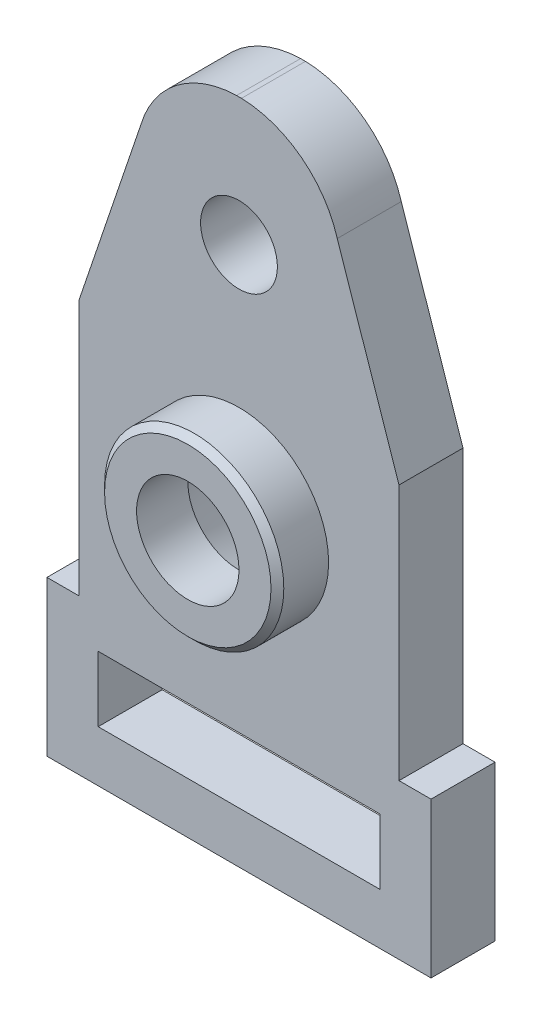
from build123d import *

# Parameters (mm, degrees)
SKETCH_1_W          = 4
SKETCH_1_H          = 5.1
EXTRUDE_1_DEPTH     = 5
SKETCH_2_R          = 3
CUT_EXTRUDE_1_DEPTH = 10
SKETCH_3_R          = 7
SKETCH_3_R_2        = 4
EXTRUDE_2_DEPTH     = 4
CHAMFER_1_SIZE      = 0.5
SKETCH_4_R          = 4
CUT_EXTRUDE_2_DEPTH = 10
CUT_EXTRUDE_2_DRAFT = 20


with BuildPart() as part:
    # Эскиз1 → Бобышка-Вытянуть1 (new body)
    with BuildSketch(Plane.XY):
        with BuildLine():
            ThreePointArc((7.674867745, 14.259797906), (4.86875016, 18.350131705), (0.190816738, 20))
            Line((0.190816738, 20), (-0.190816738, 20))
            ThreePointArc((-0.190816738, 20), (-4.86875016, 18.350131705), (-7.674867745, 14.259797906))
            Line((-7.674867745, 14.259797906), (-12.5, 0))
            Line((-12.5, 0), (-12.5, -20))
            Line((-12.5, -20), (12.5, -20))
            Line((12.5, -20), (12.5, 0))
            Line((12.5, 0), (7.674867745, 14.259797906))
        make_face()
        Polygon((15, -32.1), (15, -28.1), (11, -28.1), (-11, -28.1), (-15, -28.1), (-15, -32.1), align=None)
        with Locations((13, -25.55)):
            Rectangle(SKETCH_1_W, SKETCH_1_H)
        Polygon((15, -20), (12.5, -20), (-12.5, -20), (-15, -20), (-15, -23), (-11, -23), (11, -23), (15, -23), align=None)
        with Locations((-13, -25.55)):
            Rectangle(SKETCH_1_W, SKETCH_1_H)
    extrude(amount=EXTRUDE_1_DEPTH)

    # Эскиз2 → Вырез-Вытянуть1 (cut)
    with BuildSketch(Plane.XY.offset(5)):
        with Locations((0, 10)):
            Circle(SKETCH_2_R)
    extrude(amount=-CUT_EXTRUDE_1_DEPTH, mode=Mode.SUBTRACT)

    # Эскиз3 → Бобышка-Вытянуть2 (add)
    with BuildSketch(Plane.XY.offset(5)):
        with Locations((0, -8)):
            Circle(SKETCH_3_R)
        with Locations((0, -8)):
            Circle(SKETCH_3_R_2, mode=Mode.SUBTRACT)
    extrude(amount=EXTRUDE_2_DEPTH)

    # Фаска1
    chamfer_1_edges = [part.edges().sort_by_distance(p)[0] for p in [
        (-7, -8, 9),
    ]]
    chamfer(chamfer_1_edges, length=CHAMFER_1_SIZE)


with BuildPart() as cut_extrude_2_tool:
    # Эскиз4 → Вырез-Вытянуть2 (with draft: the straight prism first)
    with BuildSketch(Plane.XY.offset(5)):
        with Locations((0, -8)):
            Circle(SKETCH_4_R)
    extrude(amount=-CUT_EXTRUDE_2_DEPTH)
    # Вырез-Вытянуть2: the draft: its side faces are tilted about the plane it starts from
    cut_extrude_2_sides = [cut_extrude_2_tool.faces().sort_by_distance(p)[0] for p in [
        (-4, -8, 0),
    ]]
    draft(cut_extrude_2_sides, Plane.XY.offset(5), CUT_EXTRUDE_2_DRAFT)


with BuildPart() as part_1:
    add(part.part)

    # Вырез-Вытянуть2: cut by cut_extrude_2_tool
    add(cut_extrude_2_tool.part, mode=Mode.SUBTRACT)


solid = part_1.part
